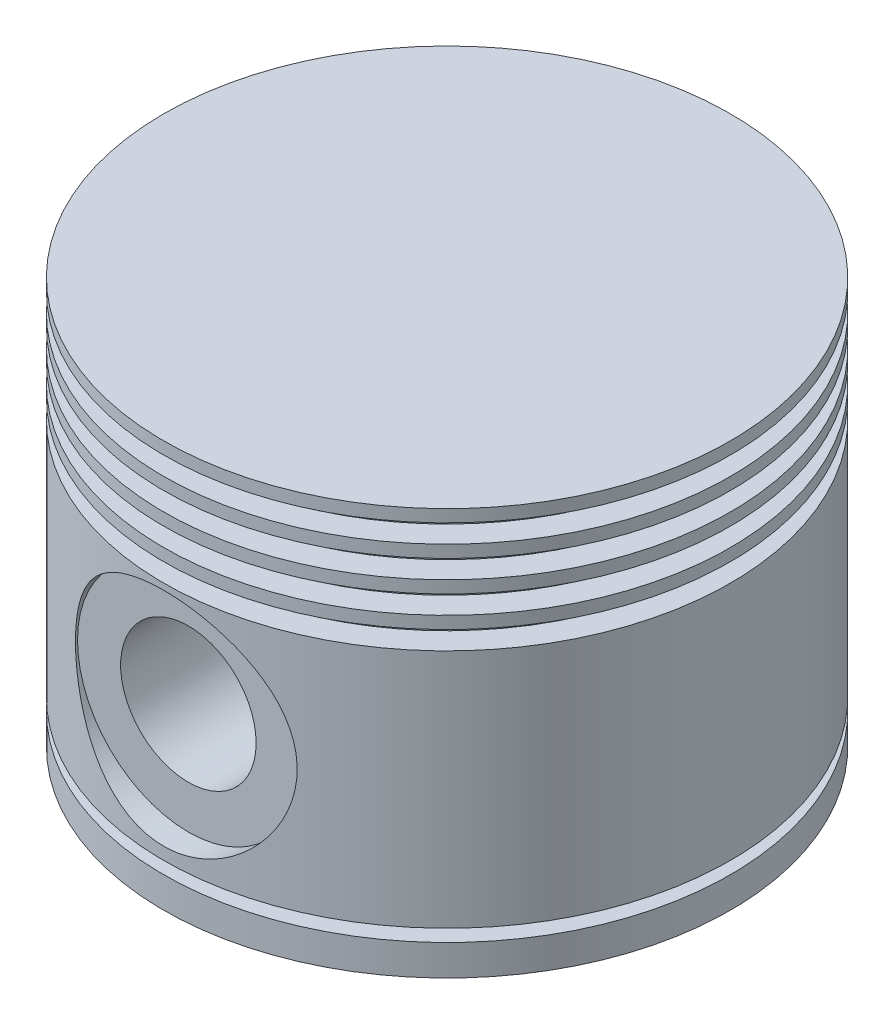
from build123d import *

# Parameters (mm, degrees)
CUT_EXTRUDE1_DEPTH       = 93.671462706
CUT_EXTRUDE1_DEPTH_BACK  = 93.671462706
SKETCH2_R                = 11
CUT_EXTRUDE3_START       = 46
SKETCH3_R                = 18
CUT_EXTRUDE3_DEPTH       = 4
BOSS_EXTRUDE2_REACH      = 119.671
BOSS_EXTRUDE2_END_RADIUS = 37
BOSS_EXTRUDE2_START      = 25
SKETCH6_R                = 18
SKETCH6_R_2              = 11


with BuildPart() as part:
    # Sketch1 → Revolve1 (revolve)
    with BuildSketch(Plane.XY):
        Polygon((0, 66), (-46, 66), (-46, 64), (-42, 64), (-42, 61), (-46, 61), (-46, 59), (-42, 59), (-42, 56), (-46, 56), (-46, 54), (-42, 54), (-42, 51), (-46, 51), (-46, 49), (-42, 49), (-42, 46), (-46, 46), (-46, 7), (-42, 7), (-42, 5), (-46, 5), (-46, 0), (-37, 0), (-37, 7), (-37, 46.016426543), (-37.463954494, 62), (0, 62), align=None)
    revolve(axis=Axis((0, 66, 0), (0, -1, 0)))

    # Sketch2 → Cut-Extrude1 (cut, two sides: drawn at the far end of the back side and taken through both)
    with BuildSketch(Plane.XY.offset(-CUT_EXTRUDE1_DEPTH_BACK)):
        with Locations((0, 27)):
            Circle(SKETCH2_R)
    extrude(amount=CUT_EXTRUDE1_DEPTH + CUT_EXTRUDE1_DEPTH_BACK, mode=Mode.SUBTRACT)

    # Sketch3 → Cut-Extrude3 (cut, symmetric)
    with BuildSketch(Plane.XY.offset(CUT_EXTRUDE3_START)):
        with Locations(Location((0, 27, 0), (0, 0, 180))):
            Circle(SKETCH3_R)
    cut_extrude3 = extrude(amount=CUT_EXTRUDE3_DEPTH, both=True, mode=Mode.SUBTRACT)

    # Mirror2: Cut-Extrude3 across plane
    add(cut_extrude3.mirror(Plane.XY), mode=Mode.SUBTRACT)

    # Boss-Extrude2: up to this cylinder (the profile starts inside it)
    boss_extrude2_end = Plane(origin=(0, 27, 0), z_dir=(0, 1, 0)) * Cylinder(BOSS_EXTRUDE2_END_RADIUS, 314.342, mode=Mode.PRIVATE)
    # Sketch6 → Boss-Extrude2 (add, up to the surface)
    with BuildSketch(Plane.XY.offset(BOSS_EXTRUDE2_START), mode=Mode.PRIVATE) as boss_extrude2_sk1:
        with Locations(Location((0, 27, 0), (0, 0, 180))):
            Circle(SKETCH6_R)
        with Locations((0, 27)):
            Circle(SKETCH6_R_2, mode=Mode.SUBTRACT)
    boss_extrude2_tool1 = extrude(boss_extrude2_sk1.sketch, amount=BOSS_EXTRUDE2_REACH, mode=Mode.PRIVATE) & boss_extrude2_end
    boss_extrude2 = boss_extrude2_tool1.solids().sort_by_distance((17.490883, 27, 25))[0]
    add(boss_extrude2)

    # Mirror4: Boss-Extrude2 across plane
    add(boss_extrude2.mirror(Plane.XY))


solid = part.part
